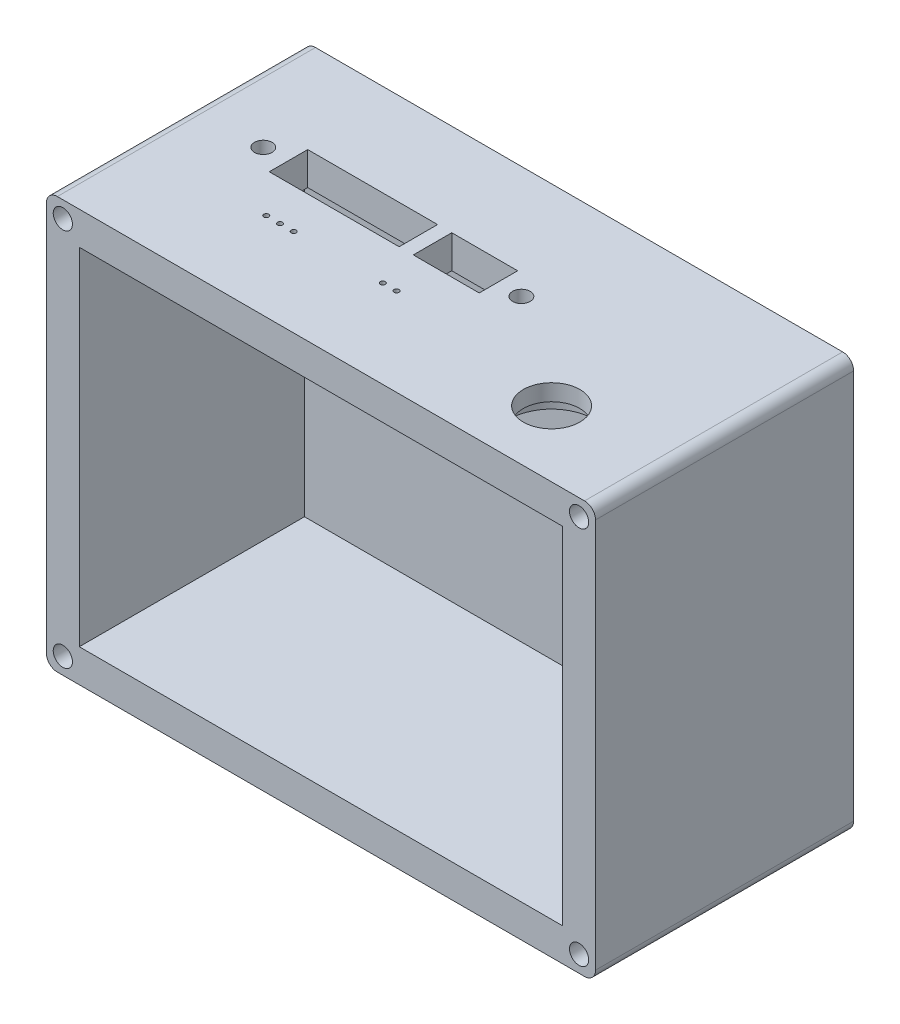
from build123d import *

# Parameters (mm, degrees)
ESQUISSE1_W             = 100
ESQUISSE1_H             = 75
BOSS_EXTRU_1_DEPTH      = 47
COQUE1_T                = -6
ESQUISSE6_R             = 1.75
ENL_V_MAT_EXTRU_1_DEPTH = 7.3
ESQUISSE7_R             = 10
ENL_V_MAT_EXTRU_2_DEPTH = 0.5
ESQUISSE9_R             = 0.455
ESQUISSE9_R_2           = 1.6
ESQUISSE9_W             = 12
ESQUISSE9_H             = 7
ESQUISSE9_W_2           = 23.65
ENL_V_MAT_EXTRU_3_DEPTH = 6
ESQUISSE10_R            = 5.15
ENL_V_MAT_EXTRU_4_DEPTH = 6
ESQUISSE11_R            = 7.75
ENL_V_MAT_EXTRU_5_DEPTH = 3
CONG_1_R                = 2


with BuildPart() as part:
    # Esquisse1 → Boss.-Extru.1 (new body)
    with BuildSketch(Plane.XY):
        Rectangle(ESQUISSE1_W, ESQUISSE1_H)
    extrude(amount=BOSS_EXTRU_1_DEPTH)

    # Coque1
    coque1_openings = [part.faces().sort_by_distance(p)[0] for p in [
        (0, 0, 47),
    ]]
    offset(amount=COQUE1_T, openings=coque1_openings, kind=Kind.INTERSECTION)

    # Esquisse6 → Enlèv. mat.-Extru.1 (cut)
    with BuildSketch(Plane.XY.offset(47)):
        with Locations((-47, 34.5)):
            Circle(ESQUISSE6_R)
        with Locations(Location((47, 34.5, 0), (0, 0, 180))):
            Circle(ESQUISSE6_R)
        with Locations((47, -34.5)):
            Circle(ESQUISSE6_R)
        with Locations(Location((-47, -34.5, 0), (0, 0, 180))):
            Circle(ESQUISSE6_R)
    extrude(amount=-ENL_V_MAT_EXTRU_1_DEPTH, mode=Mode.SUBTRACT)

    # Esquisse7 → Enlèv. mat.-Extru.2 (cut)
    with BuildSketch(Plane(origin=(0, 0, 0), x_dir=(-1, 0, 0), z_dir=(0, 0, -1))):
        with Locations((-35, 22.5)):
            Circle(ESQUISSE7_R)
        with Locations(Location((35, 22.5, 0), (0, 0, 180))):
            Circle(ESQUISSE7_R)
        with Locations(Location((-35, -22.5, 0), (0, 0, 180))):
            Circle(ESQUISSE7_R)
        with Locations((35, -22.5)):
            Circle(ESQUISSE7_R)
    extrude(amount=-ENL_V_MAT_EXTRU_2_DEPTH, mode=Mode.SUBTRACT)

    # Esquisse9 → Enlèv. mat.-Extru.3 (cut)
    with BuildSketch(Plane(origin=(0, 37.5, 0), x_dir=(1, 0, 0), z_dir=(0, 1, 0))):
        with Locations(Location((-4.73, -31, 0), (0, 0, 270))):
            Circle(ESQUISSE9_R)
        with Locations(Location((-2.23, -31, 0), (0, 0, 270))):
            Circle(ESQUISSE9_R)
        with Locations(Location((10, -20.5, 0), (0, 0, 270))):
            Circle(ESQUISSE9_R_2)
        with Locations(Location((-20.96, -31, 0), (0, 0, 270))):
            Circle(ESQUISSE9_R)
        with Locations(Location((-23.46, -31, 0), (0, 0, 270))):
            Circle(ESQUISSE9_R)
        with Locations(Location((-25.96, -31, 0), (0, 0, 270))):
            Circle(ESQUISSE9_R)
        with Locations(Location((-37, -20.5, 0), (0, 0, 270))):
            Circle(ESQUISSE9_R_2)
        with Locations((-0.38, -20.3)):
            Rectangle(ESQUISSE9_W, ESQUISSE9_H)
        with Locations((-20.785, -20.3)):
            Rectangle(ESQUISSE9_W_2, ESQUISSE9_H)
    extrude(amount=-ENL_V_MAT_EXTRU_3_DEPTH, mode=Mode.SUBTRACT)

    # Esquisse10 → Enlèv. mat.-Extru.4 (cut)
    with BuildSketch(Plane(origin=(0, 37.5, 0), x_dir=(1, 0, 0), z_dir=(0, 1, 0))):
        with Locations(Location((30, -35, 0), (0, 0, 270))):
            Circle(ESQUISSE10_R)
    extrude(amount=-ENL_V_MAT_EXTRU_4_DEPTH, mode=Mode.SUBTRACT)

    # Esquisse11 → Enlèv. mat.-Extru.5 (cut)
    with BuildSketch(Plane.XZ.offset(-31.5)):
        with Locations(Location((30, 35, 0), (0, 0, 270))):
            Circle(ESQUISSE11_R)
    extrude(amount=-ENL_V_MAT_EXTRU_5_DEPTH, mode=Mode.SUBTRACT)

    # Congé1
    cong_1_edges = [part.edges().sort_by_distance(p)[0] for p in [
        (50, -37.5, 23.5),
        (-50, -37.5, 23.5),
        (-50, 37.5, 23.5),
        (50, 37.5, 23.5),
    ]]
    fillet(cong_1_edges, radius=CONG_1_R)


solid = part.part
